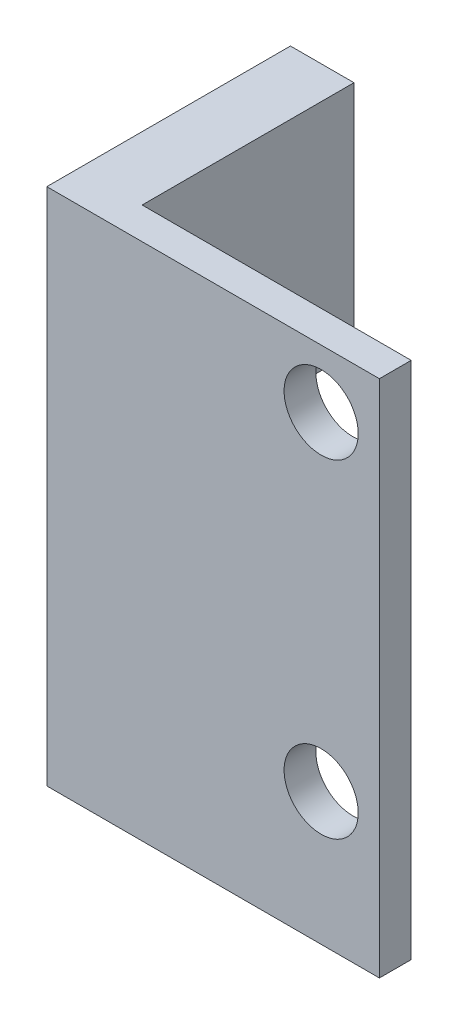
from build123d import *

# Parameters (mm, degrees)
ESQUISSE1_W        = 15.7
ESQUISSE1_H        = 24.5
ESQUISSE1_R        = 1.75
BOSS_EXTRU_1_DEPTH = 1.5
ESQUISSE2_W        = 3
ESQUISSE2_H        = 11
BOSS_EXTRU_2_DEPTH = 10


with BuildPart() as part:
    # Esquisse1 → Boss.-Extru.1 (new body)
    with BuildSketch(Plane.XY):
        with Locations((-7.85, 12.25)):
            Rectangle(ESQUISSE1_W, ESQUISSE1_H)
        with Locations((-2.75, 21.75)):
            Circle(ESQUISSE1_R, mode=Mode.SUBTRACT)
        with Locations((-2.75, 6.25)):
            Circle(ESQUISSE1_R, mode=Mode.SUBTRACT)
    extrude(amount=BOSS_EXTRU_1_DEPTH)

    # Esquisse2 → Boss.-Extru.2 (add)
    with BuildSketch(Plane(origin=(0, 0, 0), x_dir=(-1, 0, 0), z_dir=(0, 0, -1))):
        with Locations((14.2, 19)):
            Rectangle(ESQUISSE2_W, ESQUISSE2_H)
    extrude(amount=BOSS_EXTRU_2_DEPTH)


solid = part.part
